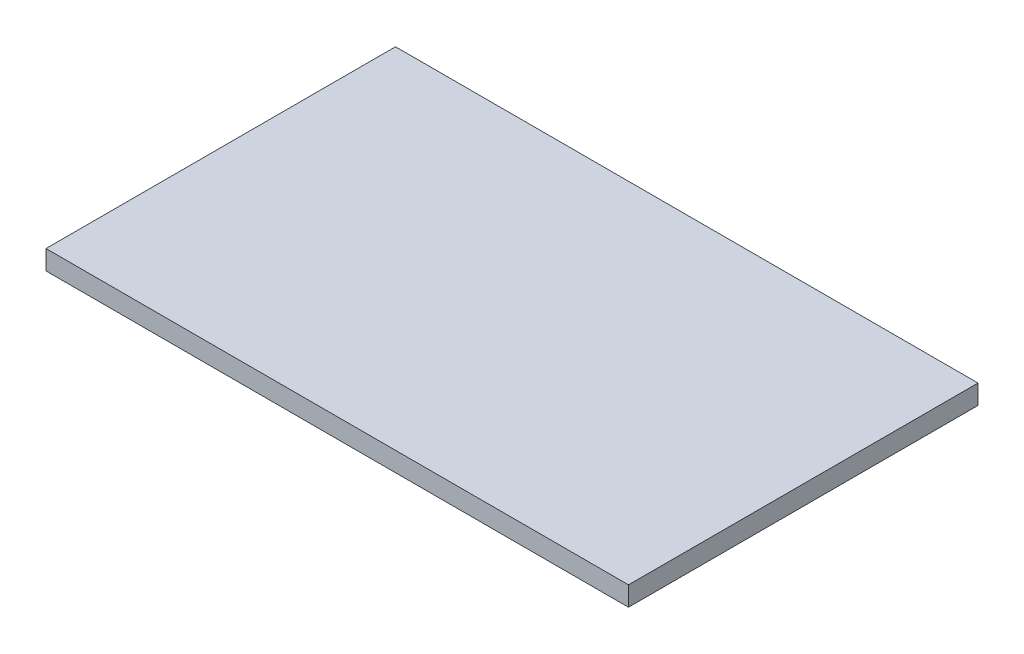
from build123d import *

# Parameters (mm, degrees)
SKETCH1_W           = 30
SKETCH1_H           = 18
BOSS_EXTRUDE1_DEPTH = 1


with BuildPart() as part:
    # Sketch1 → Boss-Extrude1 (new body)
    with BuildSketch(Plane(origin=(0, 0, 0), x_dir=(1, 0, 0), z_dir=(0, 1, 0))):
        with Locations((15, 9)):
            Rectangle(SKETCH1_W, SKETCH1_H)
    extrude(amount=BOSS_EXTRUDE1_DEPTH)


solid = part.part
